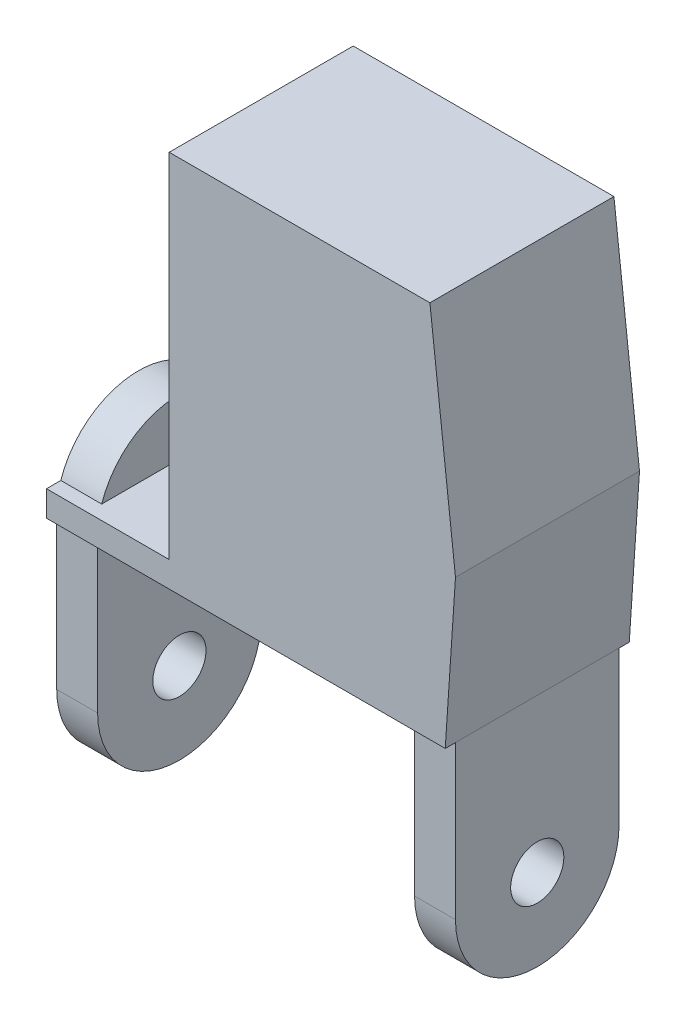
from build123d import *

# Parameters (mm, degrees)
EPIFISIS_DISTAL_DEPTH    = 18
OREJA_MEDIAL_DEPTH       = 4
OREJA_LATERAL_DEPTH      = 4
SKETCH4_R                = 2.6
AGUJERO_EJE_MUNECA_DEPTH = 1000


with BuildPart() as part:
    # Sketch1 → Epifisis_distal (new body)
    with BuildSketch(Plane.XY.offset(-9)):
        Polygon((-7.5, 52), (18, 52), (20.5, 30), (19.5, 15), (-19.5, 15), (-19.5, 17.5), (-7.5, 17.5), align=None)
    extrude(amount=EPIFISIS_DISTAL_DEPTH)

    # Sketch2 → Oreja_medial (add)
    with BuildSketch(Plane(origin=(-19.5, 0, 0), x_dir=(0, 0, -1), z_dir=(1, 0, 0))):
        with BuildLine():
            Line((8, 15), (8, 0))
            ThreePointArc((8, 0), (0, -8), (-8, 0))
            Line((-8, 0), (-8, 15))
            ThreePointArc((-8, 15), (0, 23), (8, 15))
        make_face()
    extrude(amount=OREJA_MEDIAL_DEPTH)

    # Sketch3 → Oreja_lateral (add)
    with BuildSketch(Plane(origin=(15.5, 0, 0), x_dir=(0, 0, -1), z_dir=(1, 0, 0))):
        with BuildLine():
            Line((8, 15), (8, 0))
            ThreePointArc((8, 0), (0, -8), (-8, 0))
            Line((-8, 0), (-8, 15))
            ThreePointArc((-8, 15), (0, 23), (8, 15))
        make_face()
    extrude(amount=OREJA_LATERAL_DEPTH)

    # Sketch4 → Agujero_eje_muneca (cut, symmetric)
    with BuildSketch(Plane(origin=(0, 0, 0), x_dir=(0, 0, -1), z_dir=(1, 0, 0))):
        Circle(SKETCH4_R)
    extrude(amount=AGUJERO_EJE_MUNECA_DEPTH, both=True, mode=Mode.SUBTRACT)


solid = part.part
